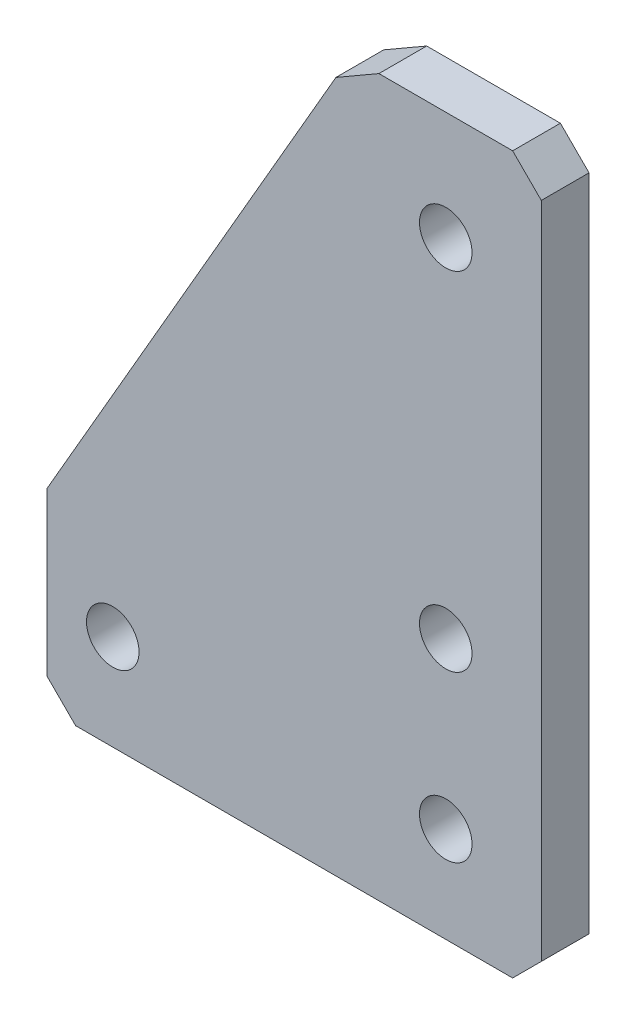
from build123d import *

# Parameters (mm, degrees)
SKETCH1_R           = 2.75
BOSS_EXTRUDE1_DEPTH = 5
CHAMFER1_SIZE       = 3


with BuildPart() as part:
    # Sketch1 → Boss-Extrude1 (new body)
    with BuildSketch(Plane.XY.offset(847.256699138)):
        Polygon((445.331056746, -16.940654003), (425.331056746, -16.940654003), (393.576791941, -71.940654003), (393.576791941, -91.940654003), (445.331056746, -91.940654003), align=None)
        with Locations(Location((435.331056746, -28.311683021, 0), (0, 0, 180))):
            Circle(SKETCH1_R, mode=Mode.SUBTRACT)
        with Locations(Location((435.331056746, -64.663237098, 0), (0, 0, 180))):
            Circle(SKETCH1_R, mode=Mode.SUBTRACT)
        with Locations(Location((400.469639923, -81.940654003, 0), (0, 0, 180))):
            Circle(SKETCH1_R, mode=Mode.SUBTRACT)
        with Locations(Location((435.331056746, -81.940654003, 0), (0, 0, 180))):
            Circle(SKETCH1_R, mode=Mode.SUBTRACT)
    extrude(amount=-BOSS_EXTRUDE1_DEPTH)

    # Chamfer1
    chamfer1_edges = [part.edges().sort_by_distance(p)[0] for p in [
        (445.331056746, -91.940654003, 844.756699138),
        (393.576791941, -91.940654003, 844.756699138),
        (425.331056746, -16.940654003, 844.756699138),
        (445.331056746, -16.940654003, 844.756699138),
    ]]
    chamfer(chamfer1_edges, length=CHAMFER1_SIZE)


solid = part.part
